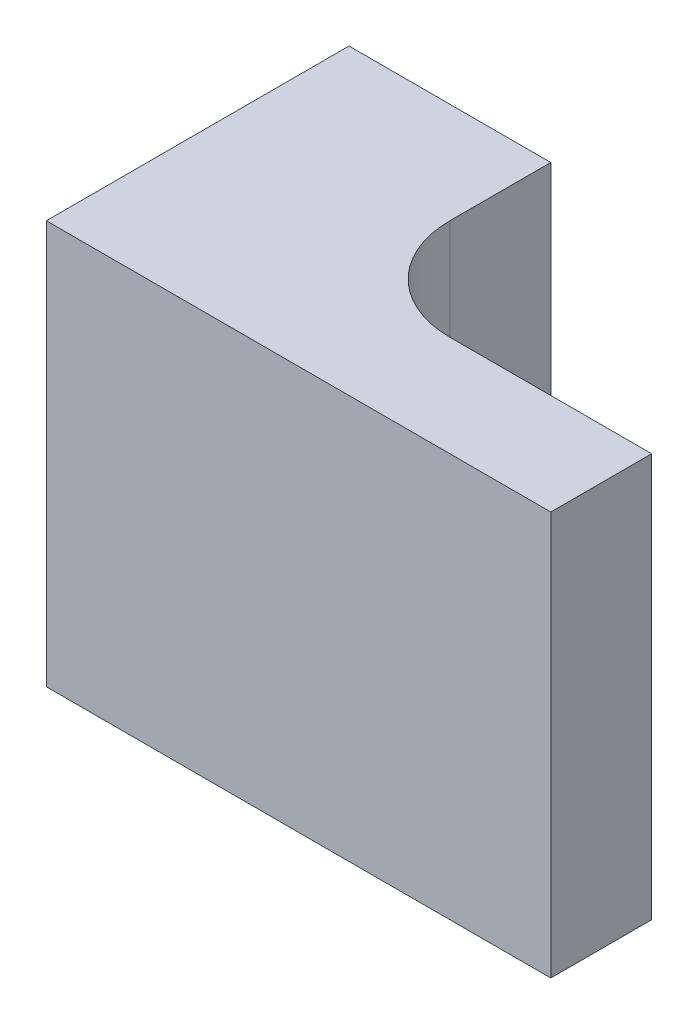
from build123d import *

# Parameters (mm, degrees)
BOSS_EXTRUDE1_DEPTH = 20


with BuildPart() as part:
    # Sketch2 → Boss-Extrude1 (new body)
    with BuildSketch(Plane(origin=(0, 0, 0), x_dir=(1, 0, 0), z_dir=(0, 1, 0))):
        with BuildLine():
            Line((0, 0), (0, -5))
            ThreePointArc((0, -5), (1.464466094, -8.535533906), (5, -10))
            Line((5, -10), (15, -10))
            Line((15, -10), (15, -15))
            Line((15, -15), (-10, -15))
            Line((-10, -15), (-10, 0))
            Line((-10, 0), (0, 0))
        make_face()
    extrude(amount=BOSS_EXTRUDE1_DEPTH)


solid = part.part
